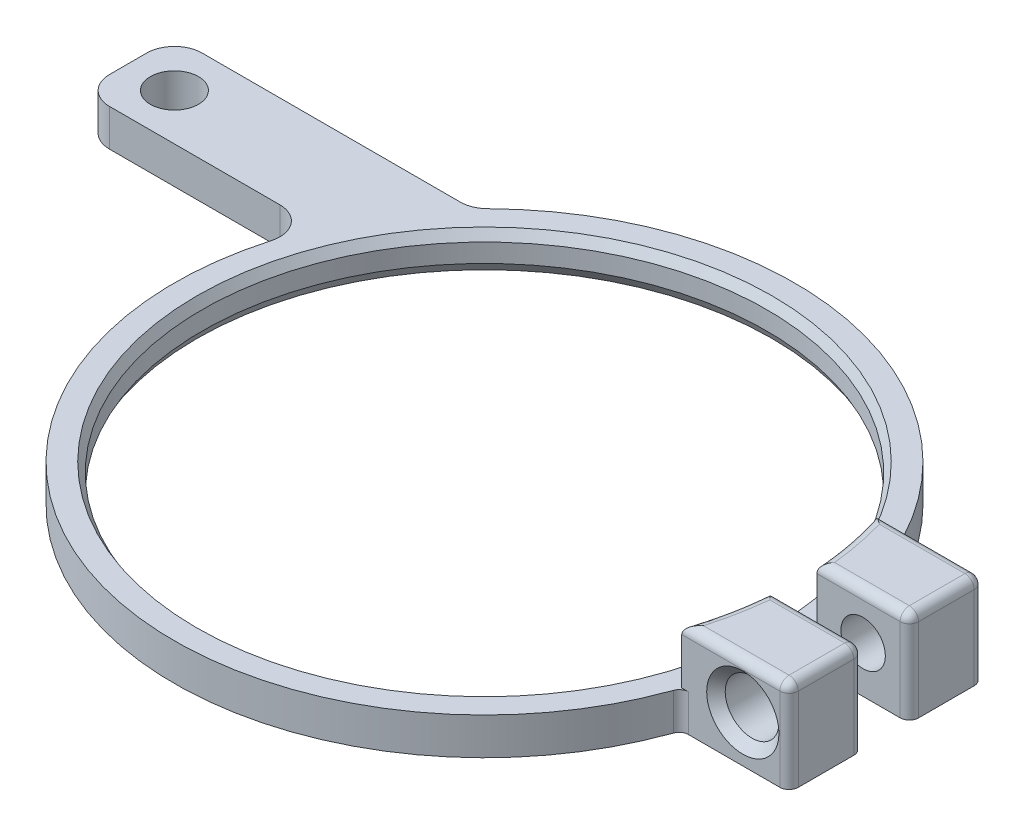
from build123d import *

# Parameters (mm, degrees)
SKETCH_1_R          = 33.5
SKETCH_1_R_2        = 30.5
EXTRUDE_1_DEPTH     = 2
SKETCH_3_W          = 10
SKETCH_3_H          = 5
CUT_EXTRUDE_1_DEPTH = 48.544715795
EXTRUDE_START       = 10
EXTRUDE_2_DEPTH     = 10
SKETCH_5_R          = 2.9
CUT_EXTRUDE_2_DEPTH = 6
SKETCH_6_R          = 2.4
CUT_EXTRUDE_3_DEPTH = 59.242009954
FILLET_9_R          = 1
FILLET_11_R         = 1
FILLET_12_R         = 1
CHAMFER_1_SIZE      = 1
SKETCH_7_R          = 2.6
EXTRUDE_3_DEPTH     = 4
FILLET_13_R         = 3
CHAMFER_2_SIZE      = 1
CHAMFER_2_SIZE2     = 0.577350269
CHAMFER_3_SIZE      = 1
CHAMFER_3_SIZE2     = 0.577350269
FILLET_14_R         = 1


with BuildPart() as part:
    # 草圖1 → 填料-伸長1 (new, symmetric)
    with BuildSketch(Plane(origin=(0, 0, 0), x_dir=(1, 0, 0), z_dir=(0, 1, 0))):
        with Locations(Location((0, 0, 0), (0, 0, 270))):
            Circle(SKETCH_1_R)
        with Locations(Location((0, 0, 0), (0, 0, 270))):
            Circle(SKETCH_1_R_2, mode=Mode.SUBTRACT)
    extrude(amount=EXTRUDE_1_DEPTH, both=True)

    # 草圖3 → 除料-伸長1 (cut, through all)
    with BuildSketch(Plane(origin=(0, 2, 0), x_dir=(1, 0, 0), z_dir=(0, 1, 0))):
        with Locations((35.397368307, 0)):
            Rectangle(SKETCH_3_W, SKETCH_3_H)
    extrude(amount=-CUT_EXTRUDE_1_DEPTH, mode=Mode.SUBTRACT)

    # 草圖4 → 填料-伸長2 (add)
    with BuildSketch(Plane(origin=(0, -2, 0), x_dir=(1, 0, 0), z_dir=(0, 1, 0)).offset(EXTRUDE_START)):
        with BuildLine():
            Line((33.406586177, -2.5), (43.406586177, -2.5))
            Line((43.406586177, -2.5), (43.406586177, -10.5))
            Line((43.406586177, -10.5), (31.811947441, -10.5))
            ThreePointArc((31.811947441, -10.5), (32.853679883, -6.548718819), (33.406586177, -2.5))
        make_face()
        with BuildLine():
            Line((43.406586177, 10.5), (31.811947441, 10.5))
            ThreePointArc((31.811947441, 10.5), (32.853679883, 6.548718819), (33.406586177, 2.5))
            Line((33.406586177, 2.5), (43.406586177, 2.5))
            Line((43.406586177, 2.5), (43.406586177, 10.5))
        make_face()
    extrude(amount=-EXTRUDE_2_DEPTH)

    # 草圖5 → 除料-伸長2 (cut)
    with BuildSketch(Plane.XY.offset(10.5)):
        with Locations((38.406586177, 3)):
            Circle(SKETCH_5_R)
    extrude(amount=-CUT_EXTRUDE_2_DEPTH, mode=Mode.SUBTRACT)

    # 草圖6 → 除料-伸長3 (cut, through all)
    with BuildSketch(Plane.XY.offset(4.5)):
        with Locations((38.406586177, 3)):
            Circle(SKETCH_6_R)
    extrude(amount=-CUT_EXTRUDE_3_DEPTH, mode=Mode.SUBTRACT)

    # 圓角9
    fillet_9_edges = [part.edges().sort_by_distance(p)[0] for p in [
        (31.811947441, 0, 10.5),
        (31.811947441, 0, -10.5),
    ]]
    fillet(fillet_9_edges, radius=FILLET_9_R)

    # 圓角11
    fillet_11_edges = [part.edges().sort_by_distance(p)[0] for p in [
        (43.406586177, 3, 10.5),
        (43.406586177, 3, 2.5),
        (43.406586177, 3, -2.5),
        (43.406586177, 3, -10.5),
    ]]
    fillet(fillet_11_edges, radius=FILLET_11_R)

    # 圓角12
    fillet_12_edges = [part.edges().sort_by_distance(p)[0] for p in [
        (43.406586177, 8, -6.5),
        (43.113692958, 8, -2.792893219),
        (43.113692958, 8, -10.207106781),
        (37.906586177, 8, 2.5),
        (43.406586177, 8, 6.5),
        (43.113692958, 8, 10.207106781),
        (43.113692958, 8, 2.792893219),
        (32.853679883, 8, 6.548718819),
        (37.109266809, 8, 10.5),
        (32.853679883, 8, -6.548718819),
        (37.906586177, 8, -2.5),
        (37.109266809, 8, -10.5),
    ]]
    fillet(fillet_12_edges, radius=FILLET_12_R)

    # 導角1
    chamfer_1_edges = [part.edges().sort_by_distance(p)[0] for p in [
        (35.506586177, 3, 10.5),
    ]]
    chamfer(chamfer_1_edges, length=CHAMFER_1_SIZE)

    # 草圖7 → 填料-伸長3 (add)
    with BuildSketch(Plane(origin=(0, 2, 0), x_dir=(1, 0, 0), z_dir=(0, 1, 0))):
        with BuildLine():
            Line((-30.874746963, 13), (-56.5, 13))
            Line((-56.5, 13), (-56.5, 23))
            Line((-56.5, 23), (-24.356723918, 23))
            ThreePointArc((-24.356723918, 23), (-28.064725972, 18.292653064), (-30.874746963, 13))
        make_face()
        with Locations(Location((-51.5, 18, 0), (0, 0, 270))):
            Circle(SKETCH_7_R, mode=Mode.SUBTRACT)
    extrude(amount=-EXTRUDE_3_DEPTH)

    # 圓角13
    fillet_13_edges = [part.edges().sort_by_distance(p)[0] for p in [
        (-30.874746963, 0, -13),
        (-24.356723918, 0, -23),
        (-56.5, 0, -23),
        (-56.5, 0, -13),
    ]]
    fillet(fillet_13_edges, radius=FILLET_13_R)

    # 導角2
    chamfer_2_edges = [part.edges().sort_by_distance(p)[0] for p in [
        (-30.5, 2, 0),
    ]]
    chamfer_2_side = [part.faces().sort_by_distance(p)[0] for p in [
        (-30.5, 0, 0),
    ]]
    chamfer(chamfer_2_edges, length=CHAMFER_2_SIZE, length2=CHAMFER_2_SIZE2, reference=chamfer_2_side[0])

    # 導角3
    chamfer_3_edges = [part.edges().sort_by_distance(p)[0] for p in [
        (-30.5, -2, 0),
    ]]
    chamfer_3_side = [part.faces().sort_by_distance(p)[0] for p in [
        (-30.5, -0.5, 0),
    ]]
    chamfer(chamfer_3_edges, length=CHAMFER_3_SIZE, length2=CHAMFER_3_SIZE2, reference=chamfer_3_side[0])

    # 圓角14
    fillet_14_edges = [part.edges().sort_by_distance(p)[0] for p in [
        (30.397368307, 0, -2.5),
        (30.397368307, 0, 2.5),
    ]]
    fillet(fillet_14_edges, radius=FILLET_14_R)


solid = part.part
